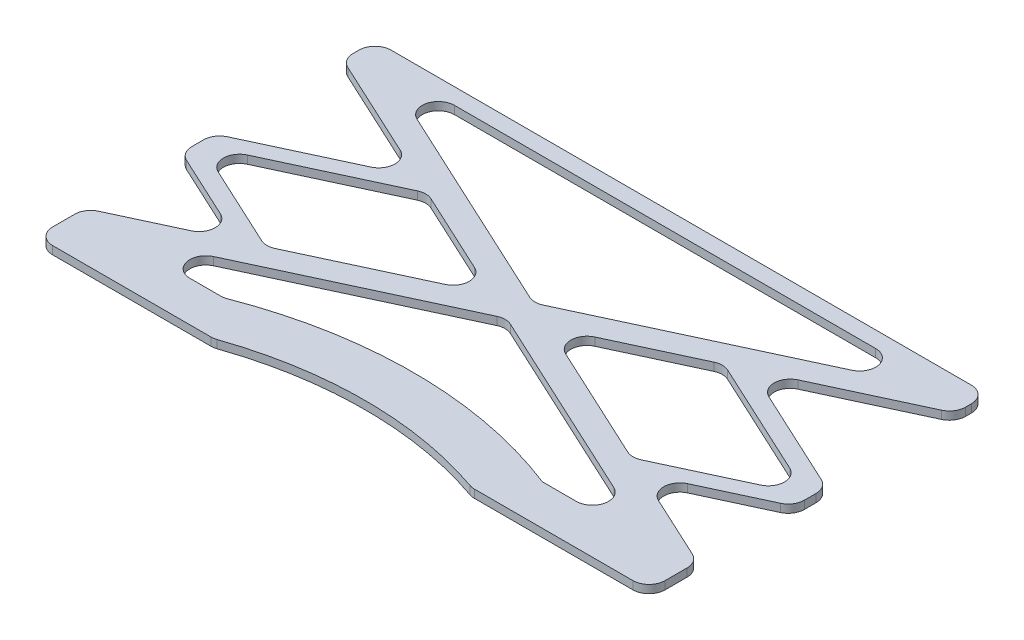
from build123d import *

# Parameters (mm, degrees)
BOSS_EXTRUDE1_DEPTH = 3.175
FILLET1_R           = 6.35
FILLET2_R           = 6.35


with BuildPart() as part:
    # Sketch1 → Boss-Extrude1 (new body)
    with BuildSketch(Plane(origin=(0, 0, 0), x_dir=(1, 0, 0), z_dir=(0, 1, 0))):
        with BuildLine():
            Line((-120.65, 0), (120.65, 0))
            Line((120.65, 0), (120.65, -12.7))
            Line((120.65, -12.7), (65.976752043, -38.1))
            Line((65.976752043, -38.1), (120.65, -63.5))
            Line((120.65, -63.5), (120.65, -76.2))
            Line((120.65, -76.2), (79.645064032, -95.25))
            Line((79.645064032, -95.25), (120.65, -114.3))
            Line((120.65, -114.3), (120.65, -133.35))
            Line((120.65, -133.35), (50.8, -133.35))
            ThreePointArc((50.8, -133.35), (0, -124.634097937), (-50.8, -133.35))
            Line((-50.8, -133.35), (-120.65, -133.35))
            Line((-120.65, -133.35), (-120.65, -114.3))
            Line((-120.65, -114.3), (-79.645064032, -95.25))
            Line((-79.645064032, -95.25), (-120.65, -76.2))
            Line((-120.65, -76.2), (-120.65, -63.5))
            Line((-120.65, -63.5), (-65.976752043, -38.1))
            Line((-65.976752043, -38.1), (-120.65, -12.7))
            Line((-120.65, -12.7), (-120.65, 0))
        make_face()
        Polygon((-111.711303819, -6.35), (111.711303819, -6.35), (0, -58.248638237), align=None, mode=Mode.SUBTRACT)
        Polygon((-58.441082652, -41.600907842), (-119.246973209, -69.85), (-72.109394642, -91.749092158), (-11.303504085, -63.5), align=None, mode=Mode.SUBTRACT)
        Polygon((11.303504085, -63.5), (58.441082652, -41.600907842), (119.246973209, -69.85), (72.109394642, -91.749092158), align=None, mode=Mode.SUBTRACT)
        with BuildLine():
            Line((-104.877147824, -117.475), (0, -68.751361763))
            Line((0, -68.751361763), (104.877147824, -117.475))
            Line((104.877147824, -117.475), (62.737522787, -117.475))
            ThreePointArc((62.737522787, -117.475), (0, -105.584097937), (-62.737522787, -117.475))
            Line((-62.737522787, -117.475), (-104.877147824, -117.475))
        make_face(mode=Mode.SUBTRACT)
    extrude(amount=BOSS_EXTRUDE1_DEPTH)

    # Fillet1
    fillet1_edges = [part.edges().sort_by_distance(p)[0] for p in [
        (104.877147824, 1.5875, 117.475),
        (0, 1.5875, 68.751361763),
        (-104.877147824, 1.5875, 117.475),
        (-62.737522787, 1.5875, 117.475),
        (-111.711303819, 1.5875, 6.35),
        (0, 1.5875, 58.248638237),
        (111.711303819, 1.5875, 6.35),
        (-11.303504085, 1.5875, 63.5),
        (-58.441082652, 1.5875, 41.600907842),
        (-119.246973209, 1.5875, 69.85),
        (-72.109394642, 1.5875, 91.749092158),
        (11.303504085, 1.5875, 63.5),
        (72.109394642, 1.5875, 91.749092158),
        (119.246973209, 1.5875, 69.85),
        (58.441082652, 1.5875, 41.600907842),
    ]]
    fillet(fillet1_edges, radius=FILLET1_R)

    # Fillet2
    fillet2_edges = [part.edges().sort_by_distance(p)[0] for p in [
        (120.65, 1.5875, 12.7),
        (65.976752043, 1.5875, 38.1),
        (120.65, 1.5875, 63.5),
        (120.65, 1.5875, 76.2),
        (79.645064032, 1.5875, 95.25),
        (120.65, 1.5875, 114.3),
        (120.65, 1.5875, 133.35),
        (50.8, 1.5875, 133.35),
        (-50.8, 1.5875, 133.35),
        (-120.65, 1.5875, 133.35),
        (-120.65, 1.5875, 114.3),
        (-79.645064032, 1.5875, 95.25),
        (-120.65, 1.5875, 76.2),
        (-120.65, 1.5875, 63.5),
        (-65.976752043, 1.5875, 38.1),
        (-120.65, 1.5875, 12.7),
        (-120.65, 1.5875, 0),
        (120.65, 1.5875, 0),
    ]]
    fillet(fillet2_edges, radius=FILLET2_R)


solid = part.part
